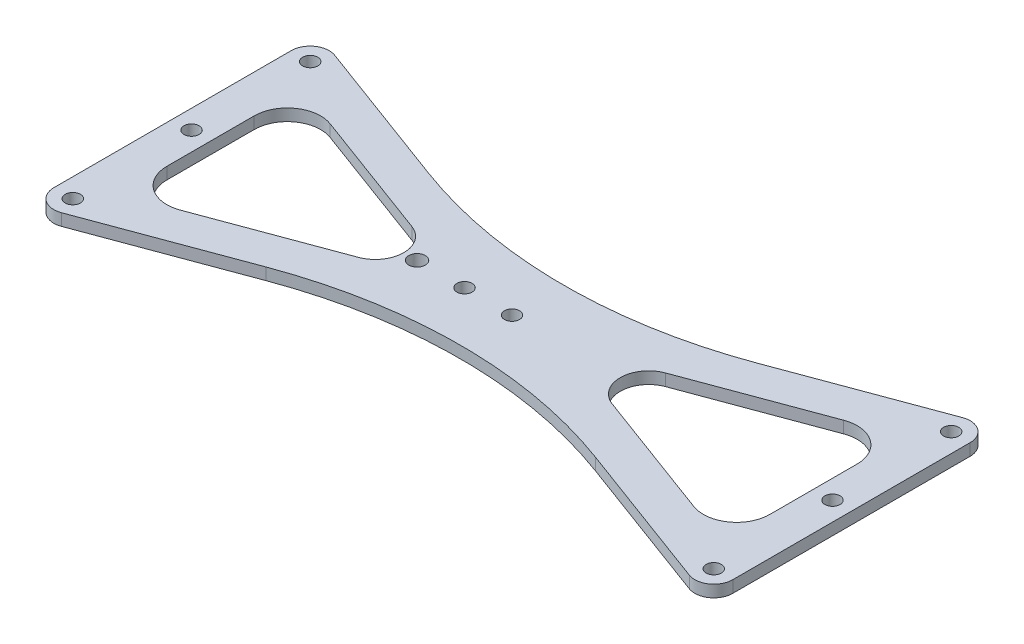
from build123d import *

# Parameters (mm, degrees)
SKETCH1_R           = 2.032
BOSS_EXTRUDE1_DEPTH = 3.175
FILLET1_R           = 8.89
FILLET2_R           = 7.62
FILLET3_R           = 127
SKETCH1_3_R         = 2.032
SKETCH1_3_R_2       = 2.2225
CUT_EXTRUDE1_DEPTH  = 99.041203328


with BuildPart() as part:
    # Sketch1 → Boss-Extrude1 (new body)
    with BuildSketch(Plane(origin=(0, 0, 0), x_dir=(1, 0, 0), z_dir=(0, 1, 0))):
        with BuildLine():
            Line((90.805, -31.75), (90.805, 31.75))
            ThreePointArc((90.805, 31.75), (88.627022296, 35.919492367), (83.960643072, 36.513763704))
            Line((83.960643072, 36.513763704), (0, 5.417229233))
            Line((0, 5.417229233), (-83.960643072, 36.513763704))
            ThreePointArc((-83.960643072, 36.513763704), (-88.627022296, 35.919492367), (-90.805, 31.75))
            Line((-90.805, 31.75), (-90.805, -31.75))
            ThreePointArc((-90.805, -31.75), (-88.627022296, -35.919492367), (-83.960643072, -36.513763704))
            Line((-83.960643072, -36.513763704), (0, -5.417229233))
            Line((0, -5.417229233), (83.960643072, -36.513763704))
            ThreePointArc((83.960643072, -36.513763704), (88.627022296, -35.919492367), (90.805, -31.75))
        make_face()
        Polygon((80.645, 24.451289285), (80.645, -24.451289285), (14.62651893, 0), align=None, mode=Mode.SUBTRACT)
        with Locations((85.725, 0)):
            Circle(SKETCH1_R, mode=Mode.SUBTRACT)
        with Locations((85.725, 31.75)):
            Circle(SKETCH1_R, mode=Mode.SUBTRACT)
        with Locations((85.725, -31.75)):
            Circle(SKETCH1_R, mode=Mode.SUBTRACT)
        Polygon((-80.645, -24.451289285), (-80.645, 24.451289285), (-14.62651893, 0), align=None, mode=Mode.SUBTRACT)
        with Locations((-85.725, -31.75)):
            Circle(SKETCH1_R, mode=Mode.SUBTRACT)
        with Locations((-85.725, 31.75)):
            Circle(SKETCH1_R, mode=Mode.SUBTRACT)
        with Locations((-85.725, 0)):
            Circle(SKETCH1_R, mode=Mode.SUBTRACT)
    extrude(amount=BOSS_EXTRUDE1_DEPTH)

    # Fillet1
    fillet1_edges = [part.edges().sort_by_distance(p)[0] for p in [
        (-80.645, 1.5875, 24.451289285),
        (-80.645, 1.5875, -24.451289285),
        (80.645, 1.5875, 24.451289285),
        (80.645, 1.5875, -24.451289285),
    ]]
    fillet(fillet1_edges, radius=FILLET1_R)

    # Fillet2
    fillet2_edges = [part.edges().sort_by_distance(p)[0] for p in [
        (14.62651893, 1.5875, 0),
        (-14.62651893, 1.5875, 0),
    ]]
    fillet(fillet2_edges, radius=FILLET2_R)

    # Fillet3
    fillet3_edges = [part.edges().sort_by_distance(p)[0] for p in [
        (0, 1.5875, 5.417229233),
        (0, 1.5875, -5.417229233),
    ]]
    fillet(fillet3_edges, radius=FILLET3_R)

    # Sketch1<3> → Cut-Extrude1 (cut, through all)
    with BuildSketch(Plane(origin=(0, 0, 0), x_dir=(1, 0, 0), z_dir=(0, 1, 0))):
        Circle(SKETCH1_3_R)
        with Locations((-12.7, 0)):
            Circle(SKETCH1_3_R)
        with Locations((-25.4, 0)):
            Circle(SKETCH1_3_R_2)
    extrude(amount=CUT_EXTRUDE1_DEPTH, mode=Mode.SUBTRACT)


solid = part.part
